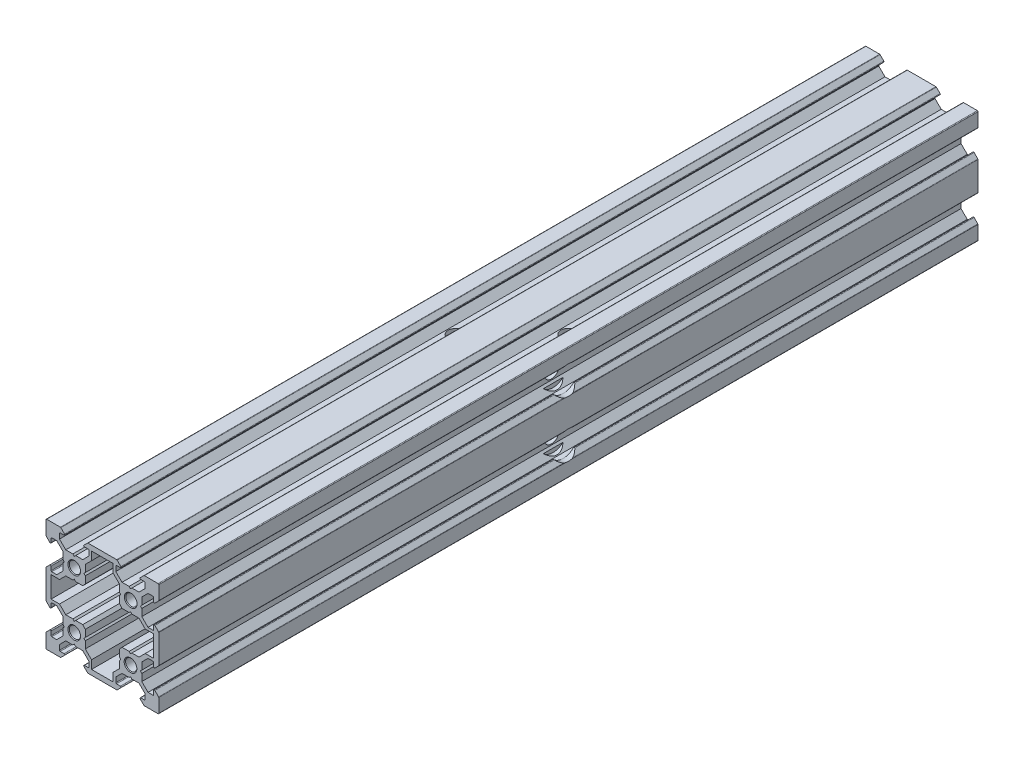
from build123d import *

# Parameters (mm, degrees)
SALIENTE_EXTRUIR1_DEPTH                              = 145
SALIENTE_EXTRUIR1_DEPTH_BACK                         = 145
CROQUIS4_R                                           = 2
CORTAR_EXTRUIR1_DEPTH                                = 294.078549681
CHAFL_N1_SIZE                                        = 0.25
REFRENTADO_PARA_TORNILLO_CON_CABEZA_HUEC_D           = 5.3
REFRENTADO_PARA_TORNILLO_CON_CABEZA_HUEC_CBORE_D     = 10
REFRENTADO_PARA_TORNILLO_CON_CABEZA_HUEC_CBORE_DEPTH = 5.4
REFRENTADO_PARA_TORNILLO_CON_CABEZA_2_D              = 5.3
REFRENTADO_PARA_TORNILLO_CON_CABEZA_2_CBORE_D        = 10
REFRENTADO_PARA_TORNILLO_CON_CABEZA_2_CBORE_DEPTH    = 5.4


with BuildPart() as part:
    # Croquis1 → Saliente-Extruir1 (new, two sides: drawn at the far end of the back side and taken through both)
    with BuildSketch(Plane.XY.offset(-SALIENTE_EXTRUIR1_DEPTH_BACK)):
        with BuildLine():
            Line((-3.509619408, 8.626776695), (-4.809619408, 9.926776695))
            ThreePointArc((-4.809619408, 9.926776695), (-4.890725245, 9.980969883), (-4.986396103, 10))
            Line((-4.986396103, 10), (-15.096446609, 10))
            ThreePointArc((-15.096446609, 10), (-15.192117467, 9.980969883), (-15.273223305, 9.926776695))
            Line((-15.273223305, 9.926776695), (-16.573223305, 8.626776695))
            ThreePointArc((-16.573223305, 8.626776695), (-16.627416493, 8.354329142), (-16.396446609, 8.2))
            Line((-16.396446609, 8.2), (-15.039949494, 8.2))
            ThreePointArc((-15.039949494, 8.2), (-14.863172798, 8.126776695), (-14.789949494, 7.95))
            Line((-14.789949494, 7.95), (-14.789949494, 6.2))
            Line((-14.789949494, 6.2), (-16.989949494, 4))
            Line((-16.989949494, 4), (-19.5, 4))
            Line((-19.5, 4), (-20, 3.5))
            Line((-20, 3.5), (-20.5, 4))
            Line((-20.5, 4), (-23.010050506, 4))
            Line((-23.010050506, 4), (-25.210050506, 6.2))
            Line((-25.210050506, 6.2), (-25.210050506, 7.95))
            ThreePointArc((-25.210050506, 7.95), (-25.136827202, 8.126776695), (-24.960050506, 8.2))
            Line((-24.960050506, 8.2), (-23.603553391, 8.2))
            ThreePointArc((-23.603553391, 8.2), (-23.372583507, 8.354329142), (-23.426776695, 8.626776695))
            Line((-23.426776695, 8.626776695), (-24.726776695, 9.926776695))
            ThreePointArc((-24.726776695, 9.926776695), (-24.807882533, 9.980969883), (-24.903553391, 10))
            Line((-24.903553391, 10), (-29.75, 10))
            ThreePointArc((-29.75, 10), (-29.926776695, 9.926776695), (-30, 9.75))
            Line((-30, 9.75), (-30, 4.903553391))
            ThreePointArc((-30, 4.903553391), (-29.980969883, 4.807882532), (-29.926776695, 4.726776695))
            Line((-29.926776695, 4.726776695), (-28.626776695, 3.426776695))
            ThreePointArc((-28.626776695, 3.426776695), (-28.354329142, 3.372583507), (-28.2, 3.603553391))
            Line((-28.2, 3.603553391), (-28.2, 4.960050506))
            ThreePointArc((-28.2, 4.960050506), (-28.126776695, 5.136827202), (-27.95, 5.210050506))
            Line((-27.95, 5.210050506), (-26.2, 5.210050506))
            Line((-26.2, 5.210050506), (-24, 3.010050506))
            Line((-24, 3.010050506), (-24, 0.5))
            Line((-24, 0.5), (-23.5, 0))
            Line((-23.5, 0), (-24, -0.5))
            Line((-24, -0.5), (-24, -3.010050506))
            Line((-24, -3.010050506), (-26.2, -5.210050506))
            Line((-26.2, -5.210050506), (-27.95, -5.210050506))
            ThreePointArc((-27.95, -5.210050506), (-28.126776695, -5.136827202), (-28.2, -4.960050506))
            Line((-28.2, -4.960050506), (-28.2, -3.603553391))
            ThreePointArc((-28.2, -3.603553391), (-28.354329142, -3.372583507), (-28.626776695, -3.426776695))
            Line((-28.626776695, -3.426776695), (-29.926776695, -4.726776695))
            ThreePointArc((-29.926776695, -4.726776695), (-29.980969883, -4.807882533), (-30, -4.903553391))
            Line((-30, -4.903553391), (-30, -6.2))
            Line((-30, -6.2), (-30, -13.717157))
            Line((-30, -13.717157), (-30, -15.013603609))
            ThreePointArc((-30, -15.013603609), (-29.980969883, -15.109274467), (-29.926776695, -15.190380305))
            Line((-29.926776695, -15.190380305), (-28.626776695, -16.490380305))
            ThreePointArc((-28.626776695, -16.490380305), (-28.354329142, -16.544573493), (-28.2, -16.313603609))
            Line((-28.2, -16.313603609), (-28.2, -14.957106494))
            ThreePointArc((-28.2, -14.957106494), (-28.126776695, -14.780329798), (-27.95, -14.707106494))
            Line((-27.95, -14.707106494), (-26.2, -14.707106494))
            Line((-26.2, -14.707106494), (-24, -16.907106494))
            Line((-24, -16.907106494), (-24, -19.417157))
            Line((-24, -19.417157), (-23.5, -19.917157))
            Line((-23.5, -19.917157), (-24, -20.417157))
            Line((-24, -20.417157), (-24, -22.927207506))
            Line((-24, -22.927207506), (-26.2, -25.127207506))
            Line((-26.2, -25.127207506), (-27.95, -25.127207506))
            ThreePointArc((-27.95, -25.127207506), (-28.126776695, -25.053984202), (-28.2, -24.877207506))
            Line((-28.2, -24.877207506), (-28.2, -23.520710391))
            ThreePointArc((-28.2, -23.520710391), (-28.354329142, -23.289740507), (-28.626776695, -23.343933695))
            Line((-28.626776695, -23.343933695), (-29.926776695, -24.643933695))
            ThreePointArc((-29.926776695, -24.643933695), (-29.980969883, -24.725039532), (-30, -24.820710391))
            Line((-30, -24.820710391), (-30, -29.667157))
            ThreePointArc((-30, -29.667157), (-29.926776695, -29.843933695), (-29.75, -29.917157))
            Line((-29.75, -29.917157), (-24.903553391, -29.917157))
            ThreePointArc((-24.903553391, -29.917157), (-24.807882533, -29.898126883), (-24.726776695, -29.843933695))
            Line((-24.726776695, -29.843933695), (-23.426776695, -28.543933695))
            ThreePointArc((-23.426776695, -28.543933695), (-23.372583507, -28.271486142), (-23.603553391, -28.117157))
            Line((-23.603553391, -28.117157), (-24.960050506, -28.117157))
            ThreePointArc((-24.960050506, -28.117157), (-25.136827202, -28.043933695), (-25.210050506, -27.867157))
            Line((-25.210050506, -27.867157), (-25.210050506, -26.117157))
            Line((-25.210050506, -26.117157), (-23.010050506, -23.917157))
            Line((-23.010050506, -23.917157), (-20.5, -23.917157))
            Line((-20.5, -23.917157), (-20, -23.417157))
            Line((-20, -23.417157), (-19.5, -23.917157))
            Line((-19.5, -23.917157), (-16.989949494, -23.917157))
            Line((-16.989949494, -23.917157), (-14.789949494, -26.117157))
            Line((-14.789949494, -26.117157), (-14.789949494, -27.867157))
            ThreePointArc((-14.789949494, -27.867157), (-14.863172798, -28.043933695), (-15.039949494, -28.117157))
            Line((-15.039949494, -28.117157), (-16.396446609, -28.117157))
            ThreePointArc((-16.396446609, -28.117157), (-16.627416493, -28.271486142), (-16.573223305, -28.543933695))
            Line((-16.573223305, -28.543933695), (-15.273223305, -29.843933695))
            ThreePointArc((-15.273223305, -29.843933695), (-15.192117467, -29.898126883), (-15.096446609, -29.917157))
            Line((-15.096446609, -29.917157), (-4.986396103, -29.917157))
            ThreePointArc((-4.986396103, -29.917157), (-4.890725245, -29.898126883), (-4.809619408, -29.843933695))
            Line((-4.809619408, -29.843933695), (-3.509619408, -28.543933695))
            ThreePointArc((-3.509619408, -28.543933695), (-3.45542622, -28.271486142), (-3.686396103, -28.117157))
            Line((-3.686396103, -28.117157), (-5.042893219, -28.117157))
            ThreePointArc((-5.042893219, -28.117157), (-5.219669914, -28.043933695), (-5.292893219, -27.867157))
            Line((-5.292893219, -27.867157), (-5.292893219, -26.117157))
            Line((-5.292893219, -26.117157), (-3.092893219, -23.917157))
            Line((-3.092893219, -23.917157), (-0.582842712, -23.917157))
            Line((-0.582842712, -23.917157), (-0.082842712, -23.417157))
            Line((-0.082842712, -23.417157), (0.417157288, -23.917157))
            Line((0.417157288, -23.917157), (2.927207794, -23.917157))
            Line((2.927207794, -23.917157), (5.127207794, -26.117157))
            Line((5.127207794, -26.117157), (5.127207794, -27.867157))
            ThreePointArc((5.127207794, -27.867157), (5.053984489, -28.043933695), (4.877207794, -28.117157))
            Line((4.877207794, -28.117157), (3.520710678, -28.117157))
            ThreePointArc((3.520710678, -28.117157), (3.289740795, -28.271486142), (3.343933983, -28.543933695))
            Line((3.343933983, -28.543933695), (4.643933983, -29.843933695))
            ThreePointArc((4.643933983, -29.843933695), (4.72503982, -29.898126883), (4.820710678, -29.917157))
            Line((4.820710678, -29.917157), (9.667157288, -29.917157))
            ThreePointArc((9.667157288, -29.917157), (9.843933983, -29.843933695), (9.917157288, -29.667157))
            Line((9.917157288, -29.667157), (9.917157288, -24.820710391))
            ThreePointArc((9.917157288, -24.820710391), (9.898127171, -24.725039533), (9.843933983, -24.643933695))
            Line((9.843933983, -24.643933695), (8.543933983, -23.343933695))
            ThreePointArc((8.543933983, -23.343933695), (8.271486429, -23.289740507), (8.117157288, -23.520710391))
            Line((8.117157288, -23.520710391), (8.117157288, -24.877207506))
            ThreePointArc((8.117157288, -24.877207506), (8.043933983, -25.053984202), (7.867157288, -25.127207506))
            Line((7.867157288, -25.127207506), (6.117157288, -25.127207506))
            Line((6.117157288, -25.127207506), (3.917157288, -22.927207506))
            Line((3.917157288, -22.927207506), (3.917157288, -20.417157))
            Line((3.917157288, -20.417157), (3.417157288, -19.917157))
            Line((3.417157288, -19.917157), (3.917157288, -19.417157))
            Line((3.917157288, -19.417157), (3.917157288, -16.907106494))
            Line((3.917157288, -16.907106494), (6.117157288, -14.707106494))
            Line((6.117157288, -14.707106494), (7.867157288, -14.707106494))
            ThreePointArc((7.867157288, -14.707106494), (8.043933983, -14.780329798), (8.117157288, -14.957106494))
            Line((8.117157288, -14.957106494), (8.117157288, -16.313603609))
            ThreePointArc((8.117157288, -16.313603609), (8.271486429, -16.544573493), (8.543933983, -16.490380305))
            Line((8.543933983, -16.490380305), (9.843933983, -15.190380305))
            ThreePointArc((9.843933983, -15.190380305), (9.898127171, -15.109274467), (9.917157288, -15.013603609))
            Line((9.917157288, -15.013603609), (9.917157288, -13.717157))
            Line((9.917157288, -13.717157), (9.917157288, -6.2))
            Line((9.917157288, -6.2), (9.917157288, -4.903553391))
            ThreePointArc((9.917157288, -4.903553391), (9.898127171, -4.807882533), (9.843933983, -4.726776695))
            Line((9.843933983, -4.726776695), (8.543933983, -3.426776695))
            ThreePointArc((8.543933983, -3.426776695), (8.271486429, -3.372583507), (8.117157288, -3.603553391))
            Line((8.117157288, -3.603553391), (8.117157288, -4.960050506))
            ThreePointArc((8.117157288, -4.960050506), (8.043933983, -5.136827202), (7.867157288, -5.210050506))
            Line((7.867157288, -5.210050506), (6.117157288, -5.210050506))
            Line((6.117157288, -5.210050506), (3.917157288, -3.010050506))
            Line((3.917157288, -3.010050506), (3.917157288, -0.5))
            Line((3.917157288, -0.5), (3.417157288, 0))
            Line((3.417157288, 0), (3.917157288, 0.5))
            Line((3.917157288, 0.5), (3.917157288, 3.010050506))
            Line((3.917157288, 3.010050506), (6.117157288, 5.210050506))
            Line((6.117157288, 5.210050506), (7.867157288, 5.210050506))
            ThreePointArc((7.867157288, 5.210050506), (8.043933983, 5.136827202), (8.117157288, 4.960050506))
            Line((8.117157288, 4.960050506), (8.117157288, 3.603553391))
            ThreePointArc((8.117157288, 3.603553391), (8.271486429, 3.372583507), (8.543933983, 3.426776695))
            Line((8.543933983, 3.426776695), (9.843933983, 4.726776695))
            ThreePointArc((9.843933983, 4.726776695), (9.898127171, 4.807882533), (9.917157288, 4.903553391))
            Line((9.917157288, 4.903553391), (9.917157288, 9.75))
            ThreePointArc((9.917157288, 9.75), (9.843933983, 9.926776695), (9.667157288, 10))
            Line((9.667157288, 10), (4.820710678, 10))
            ThreePointArc((4.820710678, 10), (4.72503982, 9.980969883), (4.643933983, 9.926776695))
            Line((4.643933983, 9.926776695), (3.343933983, 8.626776695))
            ThreePointArc((3.343933983, 8.626776695), (3.289740795, 8.354329142), (3.520710678, 8.2))
            Line((3.520710678, 8.2), (4.877207794, 8.2))
            ThreePointArc((4.877207794, 8.2), (5.053984489, 8.126776695), (5.127207794, 7.95))
            Line((5.127207794, 7.95), (5.127207794, 6.2))
            Line((5.127207794, 6.2), (2.927207794, 4))
            Line((2.927207794, 4), (0.417157288, 4))
            Line((0.417157288, 4), (-0.082842712, 3.5))
            Line((-0.082842712, 3.5), (-0.582842712, 4))
            Line((-0.582842712, 4), (-3.092893219, 4))
            Line((-3.092893219, 4), (-5.292893219, 6.2))
            Line((-5.292893219, 6.2), (-5.292893219, 7.95))
            ThreePointArc((-5.292893219, 7.95), (-5.219669914, 8.126776695), (-5.042893219, 8.2))
            Line((-5.042893219, 8.2), (-3.686396103, 8.2))
            ThreePointArc((-3.686396103, 8.2), (-3.45542622, 8.354329142), (-3.509619408, 8.626776695))
        make_face()
        Polygon((-28.2, -6.2), (-25.210050506, -6.2), (-23.010050506, -4), (-20.5, -4), (-20, -3.5), (-19.5, -4), (-16.989949494, -4), (-16.082842712, -3.010050506), (-16.082842712, -0.5), (-16.582842712, 0), (-16.082842712, 0.5), (-16.082842712, 3.010050506), (-13.882842712, 5.210050506), (-13.882842712, 8.2), (-6.2, 8.2), (-6.2, 5.210050506), (-4, 3.010050506), (-4, 0.5), (-3.5, 0), (-4, -0.5), (-4, -3.010050506), (-3.092893219, -4), (-0.582842712, -4), (-0.082842712, -3.5), (0.417157288, -4), (2.927207794, -4), (5.127207794, -6.2), (8.117157288, -6.2), (8.117157288, -13.717157), (5.127207794, -13.717157), (2.927207794, -15.917157), (0.417157288, -15.917157), (-0.082842712, -16.417157), (-0.582842712, -15.917157), (-3.092893219, -15.917157), (-4, -16.907106494), (-4, -19.417157), (-3.5, -19.917157), (-4, -20.417157), (-4, -22.927207506), (-6.2, -25.127207506), (-6.2, -28.117157), (-13.882842712, -28.117157), (-13.882842712, -25.127207506), (-16.082842712, -22.927207506), (-16.082842712, -20.417157), (-16.582842712, -19.917157), (-16.082842712, -19.417157), (-16.082842712, -16.907106494), (-16.989949494, -15.917157), (-19.5, -15.917157), (-20, -16.417157), (-20.5, -15.917157), (-23.010050506, -15.917157), (-25.210050506, -13.717157), (-28.2, -13.717157), align=None, mode=Mode.SUBTRACT)
    extrude(amount=SALIENTE_EXTRUIR1_DEPTH + SALIENTE_EXTRUIR1_DEPTH_BACK)

    # Croquis4 → Cortar-Extruir1 (cut, through all)
    with BuildSketch(Plane.XY.offset(145)):
        with Locations((-20, 0)):
            Circle(CROQUIS4_R)
        Circle(CROQUIS4_R)
        with Locations((-0.082842712, -19.917157)):
            Circle(CROQUIS4_R)
        with Locations((-20, -19.917157)):
            Circle(CROQUIS4_R)
    extrude(amount=-CORTAR_EXTRUIR1_DEPTH, mode=Mode.SUBTRACT)

    # Chaflán1
    chafl_n1_edges = [part.edges().sort_by_distance(p)[0] for p in [
        (-22, 0, -145),
        (-22, -19.917157, -145),
        (-2, 0, -145),
        (-2.082842712, -19.917157, -145),
        (-2.082842712, -19.917157, 145),
        (-2, 0, 145),
        (-22, 0, 145),
        (-22, -19.917157, 145),
    ]]
    chamfer(chafl_n1_edges, length=CHAFL_N1_SIZE)

    # Refrentado para tornillo con cabeza huec (through all)
    with Locations(Plane(origin=(0, -29.917157, 0), x_dir=(-1, 0, 0), z_dir=(0, -1, 0))):
        with Locations((20, -10), (0.082842712, 10)):
            CounterBoreHole(REFRENTADO_PARA_TORNILLO_CON_CABEZA_HUEC_D / 2, REFRENTADO_PARA_TORNILLO_CON_CABEZA_HUEC_CBORE_D / 2, REFRENTADO_PARA_TORNILLO_CON_CABEZA_HUEC_CBORE_DEPTH)

    # Refrentado para tornillo con cabeza  2 (through all)
    with Locations(Plane(origin=(9.917157288, 0, 0), x_dir=(0, 0, -1), z_dir=(1, 0, 0))):
        with Locations((0, -19.917157), (0, 0)):
            CounterBoreHole(REFRENTADO_PARA_TORNILLO_CON_CABEZA_2_D / 2, REFRENTADO_PARA_TORNILLO_CON_CABEZA_2_CBORE_D / 2, REFRENTADO_PARA_TORNILLO_CON_CABEZA_2_CBORE_DEPTH)


solid = part.part
